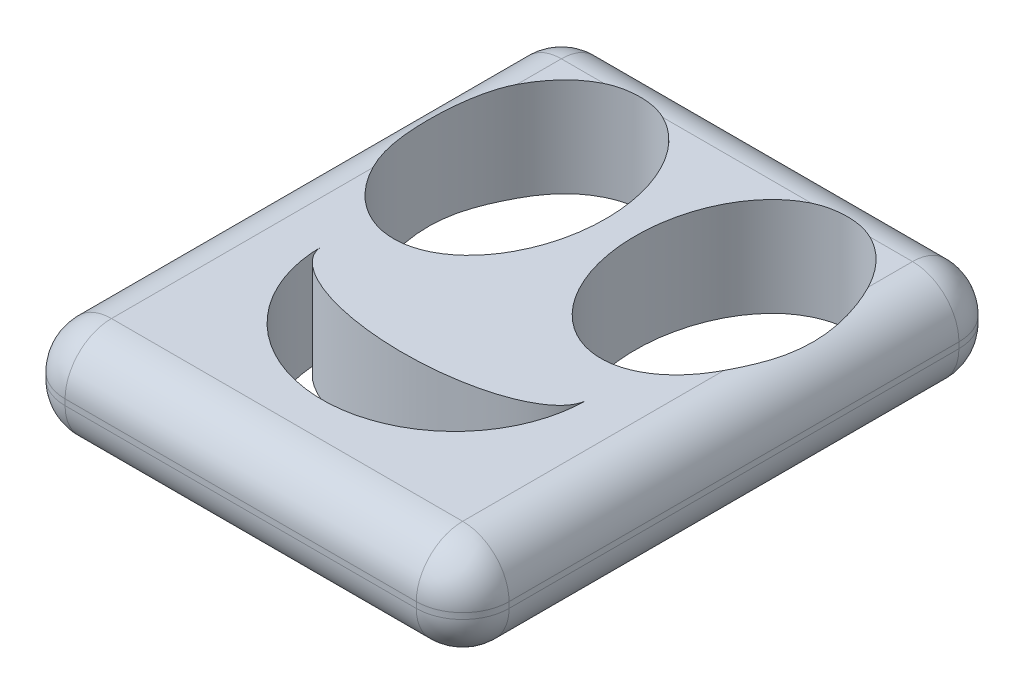
from build123d import *

# Parameters (mm, degrees)
SCHIZZO1_W                    = 45
SCHIZZO1_H                    = 55
ESTRUSIONE_ESTRUSIONE1_DEPTH  = 10
RACCORDO1_R                   = 4.7
TAGLIO_ESTRUSIONE3_DEPTH      = 20
TAGLIO_ESTRUSIONE3_DEPTH_BACK = 20
SCHIZZO3_RX                   = 12.5
SCHIZZO3_RY                   = 9
TAGLIO_ESTRUSIONE4_DEPTH      = 20


with BuildPart() as part:
    # Schizzo1 → Estrusione-Estrusione1 (new body)
    with BuildSketch(Plane(origin=(0, 0, 0), x_dir=(1, 0, 0), z_dir=(0, 1, 0))):
        Rectangle(SCHIZZO1_W, SCHIZZO1_H)
    extrude(amount=ESTRUSIONE_ESTRUSIONE1_DEPTH)

    # Raccordo1
    raccordo1_edges = [part.edges().sort_by_distance(p)[0] for p in [
        (-22.5, 10, 0),
        (0, 10, 27.5),
        (22.5, 10, 0),
        (0, 0, 27.5),
        (-22.5, 0, 0),
        (0, 0, -27.5),
        (22.5, 0, 0),
        (0, 10, -27.5),
        (22.5, 5, 27.5),
        (-22.5, 5, 27.5),
        (-22.5, 5, -27.5),
        (22.5, 5, -27.5),
    ]]
    fillet(raccordo1_edges, radius=RACCORDO1_R)

    # Schizzo3 → Taglio-Estrusione3 (cut, two sides: drawn at the far end of the back side and taken through both)
    with BuildSketch(Plane(origin=(0, 10, 0), x_dir=(1, 0, 0), z_dir=(0, 1, 0)).offset(-TAGLIO_ESTRUSIONE3_DEPTH_BACK)):
        with Locations(Location((-10.5, 11), (0, 0, -90))):
            Ellipse(SCHIZZO3_RX, SCHIZZO3_RY)
        with Locations(Location((10.5, 11), (0, 0, -90))):
            Ellipse(SCHIZZO3_RX, SCHIZZO3_RY)
    extrude(amount=TAGLIO_ESTRUSIONE3_DEPTH + TAGLIO_ESTRUSIONE3_DEPTH_BACK, mode=Mode.SUBTRACT)

    # Schizzo4 → Taglio-Estrusione4 (cut)
    with BuildSketch(Plane(origin=(0, 10, 0), x_dir=(1, 0, 0), z_dir=(0, 1, 0))):
        with BuildLine():
            ThreePointArc((13.460158557, -5.793503536), (0, -19.253662092), (-13.460158557, -5.793503536))
            add(Edge.make_bspline(
                [(-13.460158557, -5.793503536), (-13.460158557, -11.046920102), (0, -11.046920102), (13.460158557, -11.046920102), (13.460158557, -5.793503536)],
                knots=[0, 0, 0, 1.570796327, 1.570796327, 3.141592654, 3.141592654, 3.141592654], degree=2, weights=[1, 0.707106781, 1, 0.707106781, 1]))
        make_face()
    extrude(amount=-TAGLIO_ESTRUSIONE4_DEPTH, mode=Mode.SUBTRACT)


solid = part.part
